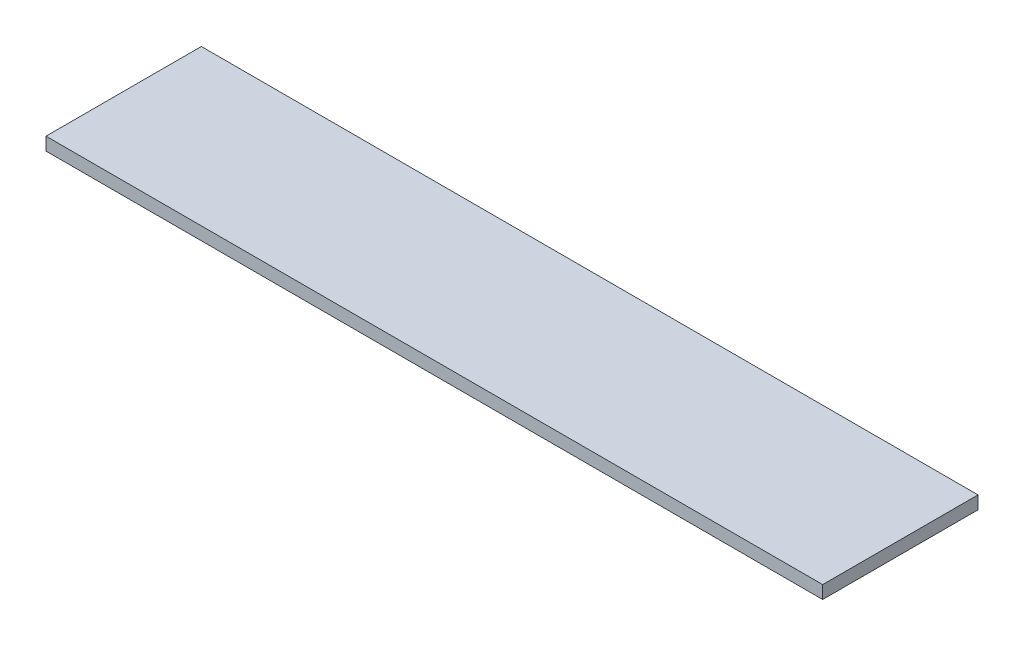
from build123d import *

# Parameters (mm, degrees)
SKETCH1_W           = 381
SKETCH1_H           = 76.2
BOSS_EXTRUDE1_DEPTH = 6.35


with BuildPart() as part:
    # Sketch1 → Boss-Extrude1 (new body)
    with BuildSketch(Plane(origin=(0, 0, 0), x_dir=(1, 0, 0), z_dir=(0, 1, 0))):
        Rectangle(SKETCH1_W, SKETCH1_H)
    extrude(amount=BOSS_EXTRUDE1_DEPTH)


solid = part.part
